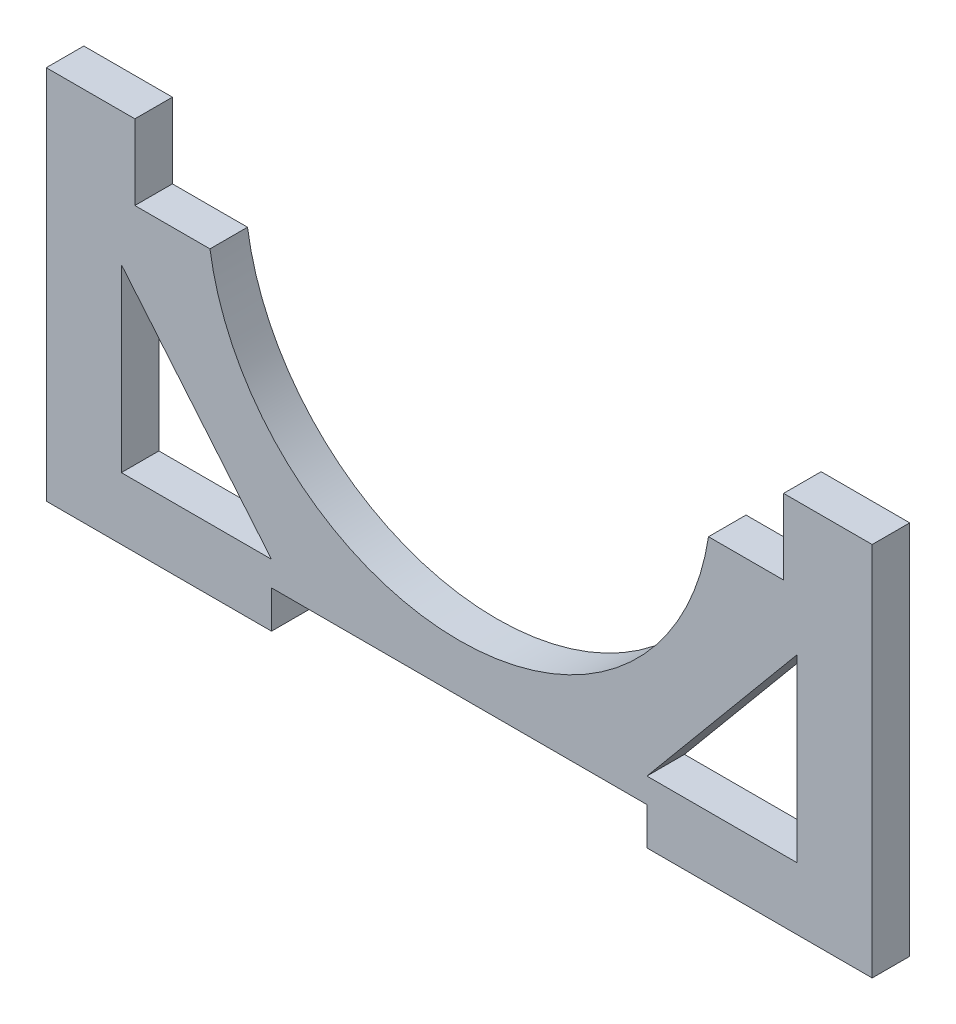
from build123d import *

# Parameters (mm, degrees)
BOSS_EXTRUDE1_DEPTH = 3.175
CUT_EXTRUDE1_DEPTH  = 46.236786745


with BuildPart() as part:
    # Sketch1 → Boss-Extrude1 (new body)
    with BuildSketch(Plane.XY):
        Polygon((-34.925, 28.575), (-34.925, -3.175), (-15.875, -3.175), (-15.875, 0), (15.875, 0), (15.875, -3.175), (34.925, -3.175), (34.925, 28.575), (27.432, 28.575), (27.432, 22.225), (-27.432, 22.225), (-27.432, 28.575), align=None)
    extrude(amount=BOSS_EXTRUDE1_DEPTH)

    # Sketch2 → Cut-Extrude1 (cut, through all)
    with BuildSketch(Plane.XY.offset(3.175)):
        with BuildLine():
            Line((-21.082, 22.225), (21.082, 22.225))
            ThreePointArc((21.082, 22.225), (0, 4.080259171), (-21.082, 22.225))
        make_face()
        Polygon((-28.575, 17.330749155), (-28.575, 2.090749155), (-15.875, 2.090749155), align=None)
        Polygon((28.575, 2.090749155), (15.875, 2.090749155), (28.575, 17.330749155), align=None)
    extrude(amount=-CUT_EXTRUDE1_DEPTH, mode=Mode.SUBTRACT)


solid = part.part
